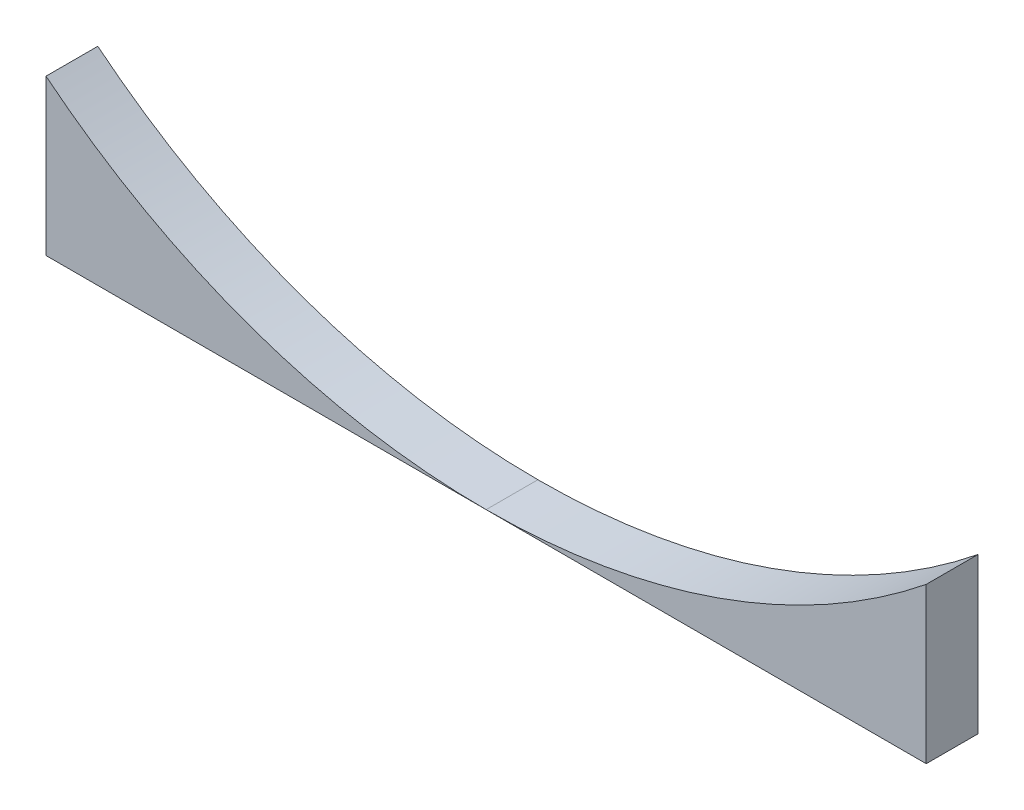
from build123d import *

# Parameters (mm, degrees)
BOSS_EXTRUDE1_DEPTH   = 20
BOSS_EXTRUDE1_2_DEPTH = 20


with BuildPart() as part:
    # Sketch1 → Boss-Extrude1 (new body)
    with BuildSketch(Plane.XY):
        with BuildLine():
            ThreePointArc((5.88e-07, 110.144459885), (-90.138781609, 125.584577775), (-170, 170.144459885))
            Line((-170, 170.144459885), (-170, 110.144459885))
            Line((-170, 110.144459885), (5.88e-07, 110.144459885))
        make_face()
    extrude(amount=BOSS_EXTRUDE1_DEPTH)


with BuildPart() as body_2:
    # Sketch1 → Boss-Extrude1 2 (new body)
    with BuildSketch(Plane.XY):
        with BuildLine():
            ThreePointArc((170, 170.144459885), (90.138782164, 125.584577971), (5.88e-07, 110.144459885))
            Line((5.88e-07, 110.144459885), (170, 110.144459885))
            Line((170, 110.144459885), (170, 170.144459885))
        make_face()
    extrude(amount=BOSS_EXTRUDE1_2_DEPTH)


solid = Compound([part.part, body_2.part])
